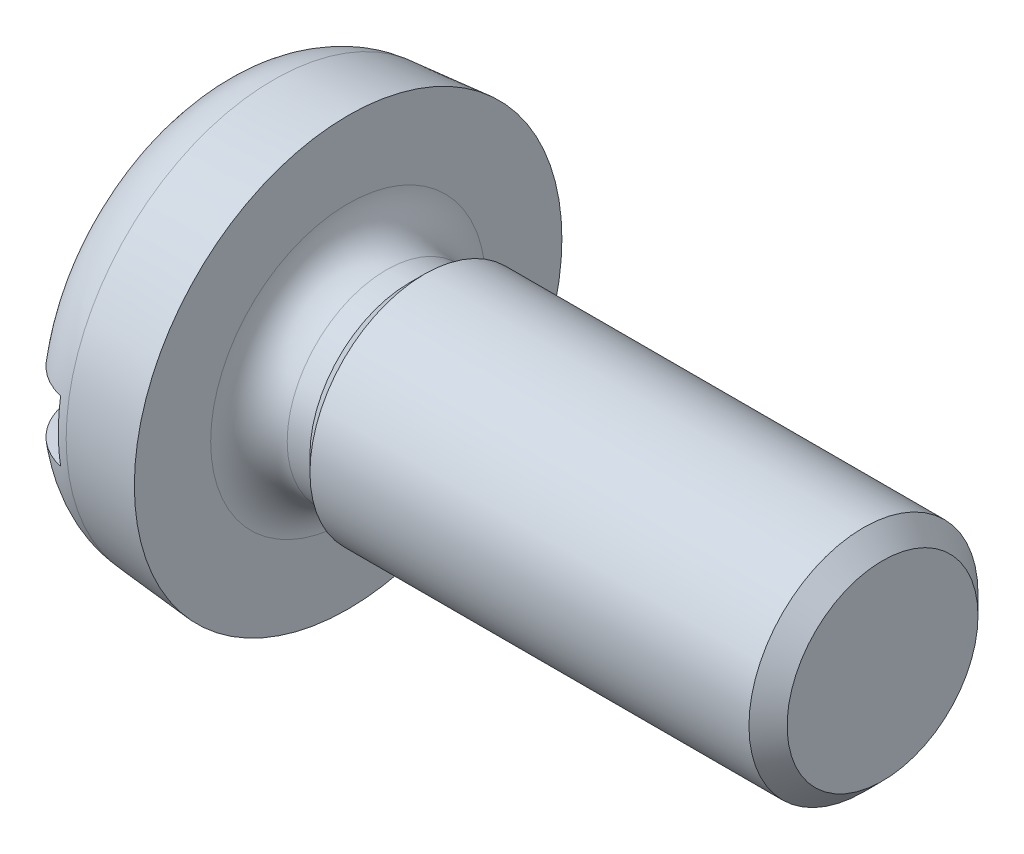
from build123d import *

# Parameters (mm, degrees)
SKETCH_4_W          = 0.7
SKETCH_4_H          = 0.8
CUT_EXTRUDE_1_DEPTH = 50
SKETCH_6_R          = 4.963910668
CUT_EXTRUDE_2_DEPTH = 5
CHAMFER_1_SIZE      = 0.25


with BuildPart() as part:
    # 草图3 → Revolve 929 (revolve)
    with BuildSketch(Plane.XY, mode=Mode.PRIVATE) as revolve_929_sk:
        with BuildLine():
            Line((0, 0), (13.8, 0))
            Line((13.8, 0), (13.8, 1.5))
            Line((13.8, 1.5), (2.8, 1.5))
            Line((2.8, 1.5), (2.599, 1.299))
            Line((2.599, 1.299), (2.301, 1.299))
            ThreePointArc((2.301, 1.299), (1.946739503, 1.445739503), (1.8, 1.8))
            Line((1.8, 1.8), (1.8, 2.8))
            Line((1.8, 2.8), (0.821559832, 2.714397577))
            ThreePointArc((0.821559832, 2.714397577), (0.236450397, 2.425853536), (0, 1.817822349))
            Line((0, 1.817822349), (0, 0))
        make_face()
    revolve(revolve_929_sk.sketch.rotate(Axis((-2.477021524, 0, 0), (1, 0, 0)), 90), axis=Axis((-2.477021524, 0, 0), (1, 0, 0)))

    # 草图4 → 切除-拉伸1 (cut, symmetric)
    with BuildSketch(Plane.XY):
        with Locations((0.35, 0)):
            Rectangle(SKETCH_4_W, SKETCH_4_H)
    extrude(amount=CUT_EXTRUDE_1_DEPTH, both=True, mode=Mode.SUBTRACT)

    # 草图5 → 切除-旋转1 (revolve, cut)
    with BuildSketch(Plane.XY, mode=Mode.PRIVATE) as cut_revolve_1_sk:
        Polygon((13.547291997, 1.5), (14.047291997, 1.5), (13.8, 1.067), align=None)
    revolve(cut_revolve_1_sk.sketch.rotate(Axis((6.174994867, 0, 0), (-1, 0, 0)), 270), axis=Axis((6.174994867, 0, 0), (-1, 0, 0)), mode=Mode.SUBTRACT)

    # 草图6 → 切除-拉伸2 (cut)
    with BuildSketch(Plane(origin=(13.8, 0, 0), x_dir=(0, 0, -1), z_dir=(1, 0, 0))):
        Circle(SKETCH_6_R)
    extrude(amount=-CUT_EXTRUDE_2_DEPTH, mode=Mode.SUBTRACT)

    # 倒角1
    chamfer_1_edges = [part.edges().sort_by_distance(p)[0] for p in [
        (8.8, 0, -1.5),
    ]]
    chamfer(chamfer_1_edges, length=CHAMFER_1_SIZE)


solid = part.part
